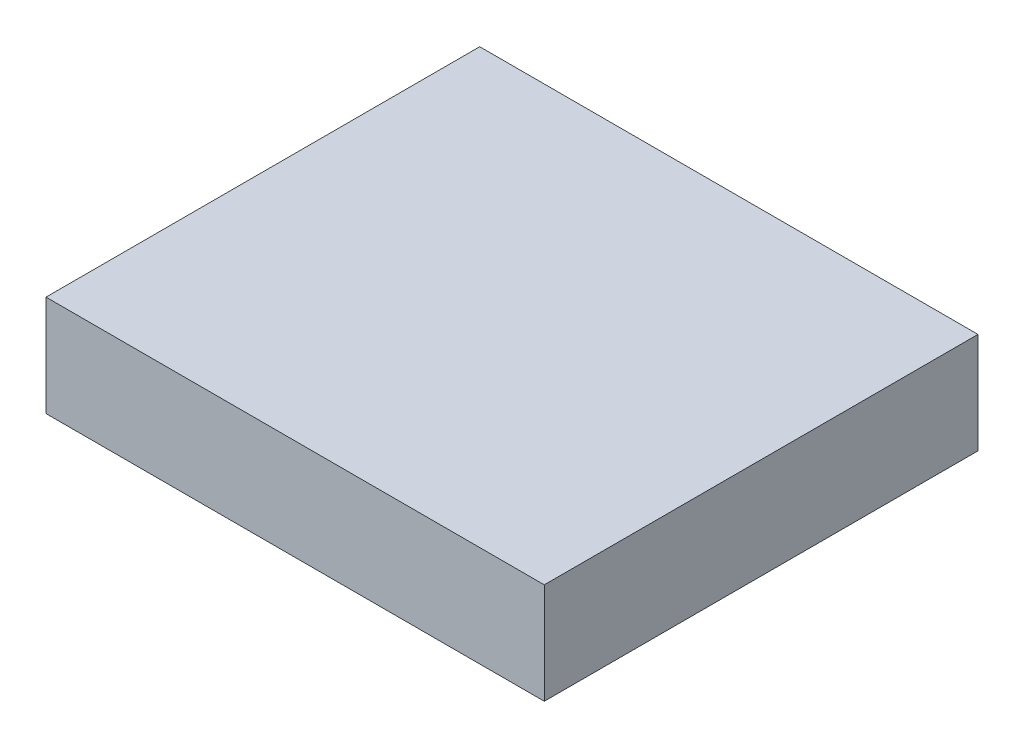
from build123d import *

# Parameters (mm, degrees)
SKETCH_1_W      = 24.7
SKETCH_1_H      = 21.5
EXTRUDE_1_DEPTH = 5


with BuildPart() as part:
    # 草图1 → 凸台-拉伸1 (new body)
    with BuildSketch(Plane(origin=(0, 0, 0), x_dir=(1, 0, 0), z_dir=(0, 1, 0))):
        with Locations((12.35, -10.75)):
            Rectangle(SKETCH_1_W, SKETCH_1_H)
    extrude(amount=EXTRUDE_1_DEPTH)


solid = part.part
